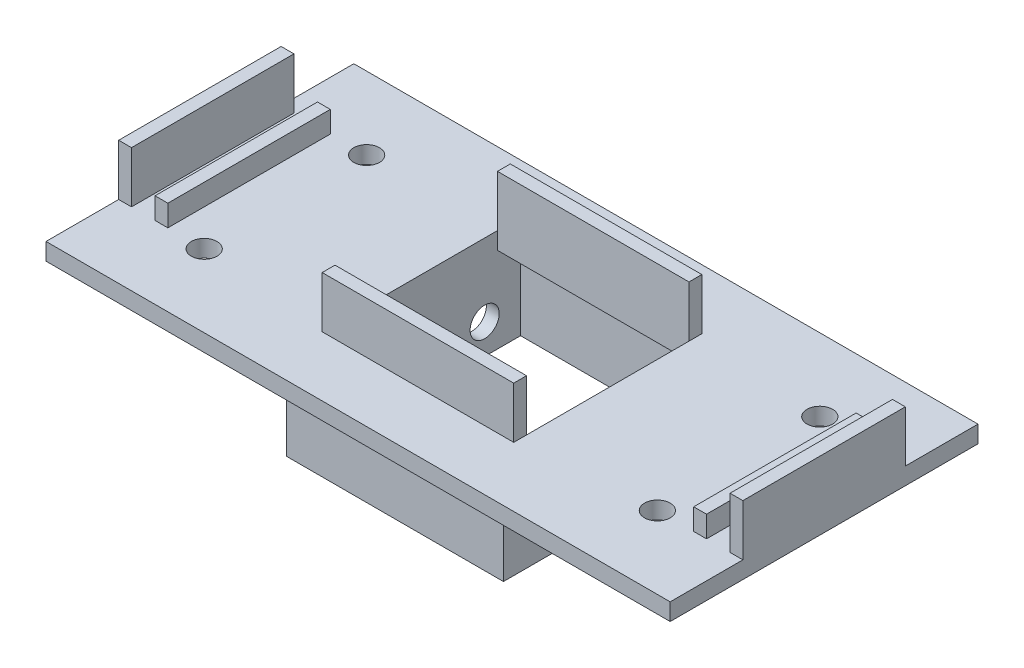
from build123d import *

# Parameters (mm, degrees)
SKETCH1_W           = 73
SKETCH1_H           = 36
BOSS_EXTRUDE1_DEPTH = 2
SKETCH2_W           = 1.5
SKETCH2_H           = 19
BOSS_EXTRUDE2_DEPTH = 6
SKETCH3_W           = 25.4
SKETCH3_H           = 27.4
SKETCH3_W_2         = 22.4
SKETCH3_H_2         = 24.4
BOSS_EXTRUDE3_DEPTH = 10
SKETCH4_W           = 22.4
SKETCH4_H           = 19
CUT_EXTRUDE1_DEPTH  = 42.907636536
SKETCH5_W           = 22.4
SKETCH5_H           = 1.5
BOSS_EXTRUDE4_DEPTH = 6
SKETCH6_R           = 1.5
CUT_EXTRUDE2_DEPTH  = 43.429353047
SKETCH7_W           = 1.5
SKETCH7_H           = 19
BOSS_EXTRUDE5_DEPTH = 2.5
SKETCH8_R           = 1.7
CUT_EXTRUDE3_DEPTH  = 54.335166635


with BuildPart() as part:
    # Sketch1 → Boss-Extrude1 (new body)
    with BuildSketch(Plane(origin=(0, 0, 0), x_dir=(1, 0, 0), z_dir=(0, 1, 0))):
        Rectangle(SKETCH1_W, SKETCH1_H)
    extrude(amount=BOSS_EXTRUDE1_DEPTH)

    # Sketch2 → Boss-Extrude2 (add)
    with BuildSketch(Plane(origin=(0, 2, 0), x_dir=(1, 0, 0), z_dir=(0, 1, 0))):
        with Locations((-35.75, 0)):
            Rectangle(SKETCH2_W, SKETCH2_H)
        with Locations((35.75, 0)):
            Rectangle(SKETCH2_W, SKETCH2_H)
    extrude(amount=BOSS_EXTRUDE2_DEPTH)

    # Sketch3 → Boss-Extrude3 (add)
    with BuildSketch(Plane.XZ):
        Rectangle(SKETCH3_W, SKETCH3_H)
        Rectangle(SKETCH3_W_2, SKETCH3_H_2, mode=Mode.SUBTRACT)
    extrude(amount=BOSS_EXTRUDE3_DEPTH)

    # Sketch4 → Cut-Extrude1 (cut, through all)
    with BuildSketch(Plane.XZ):
        Rectangle(SKETCH4_W, SKETCH4_H)
    extrude(amount=-CUT_EXTRUDE1_DEPTH, mode=Mode.SUBTRACT)

    # Sketch5 → Boss-Extrude4 (add)
    with BuildSketch(Plane(origin=(0, 2, 0), x_dir=(1, 0, 0), z_dir=(0, 1, 0))):
        with Locations((0, 10.25)):
            Rectangle(SKETCH5_W, SKETCH5_H)
        with Locations((0, -10.25)):
            Rectangle(SKETCH5_W, SKETCH5_H)
    extrude(amount=BOSS_EXTRUDE4_DEPTH)

    # Sketch6 → Cut-Extrude2 (cut, through all)
    with BuildSketch(Plane(origin=(0, 2, 0), x_dir=(1, 0, 0), z_dir=(0, 1, 0))):
        with Locations(Location((-26.5, 9.5, 0), (0, 0, 270))):
            Circle(SKETCH6_R)
        with Locations(Location((-26.5, -9.5, 0), (0, 0, 270))):
            Circle(SKETCH6_R)
        with Locations(Location((26.5, 9.5, 0), (0, 0, 270))):
            Circle(SKETCH6_R)
        with Locations(Location((26.5, -9.5, 0), (0, 0, 270))):
            Circle(SKETCH6_R)
    extrude(amount=-CUT_EXTRUDE2_DEPTH, mode=Mode.SUBTRACT)

    # Sketch7 → Boss-Extrude5 (add)
    with BuildSketch(Plane(origin=(0, 2, 0), x_dir=(1, 0, 0), z_dir=(0, 1, 0))):
        with Locations((-31.5, 0)):
            Rectangle(SKETCH7_W, SKETCH7_H)
        with Locations((31.5, 0)):
            Rectangle(SKETCH7_W, SKETCH7_H)
    extrude(amount=BOSS_EXTRUDE5_DEPTH)

    # Sketch8 → Cut-Extrude3 (cut, through all)
    with BuildSketch(Plane(origin=(12.7, 0, 0), x_dir=(0, 0, -1), z_dir=(1, 0, 0))):
        with Locations((-8, -6.5)):
            Circle(SKETCH8_R)
        with Locations((8, -6.5)):
            Circle(SKETCH8_R)
    extrude(amount=-CUT_EXTRUDE3_DEPTH, mode=Mode.SUBTRACT)


solid = part.part
